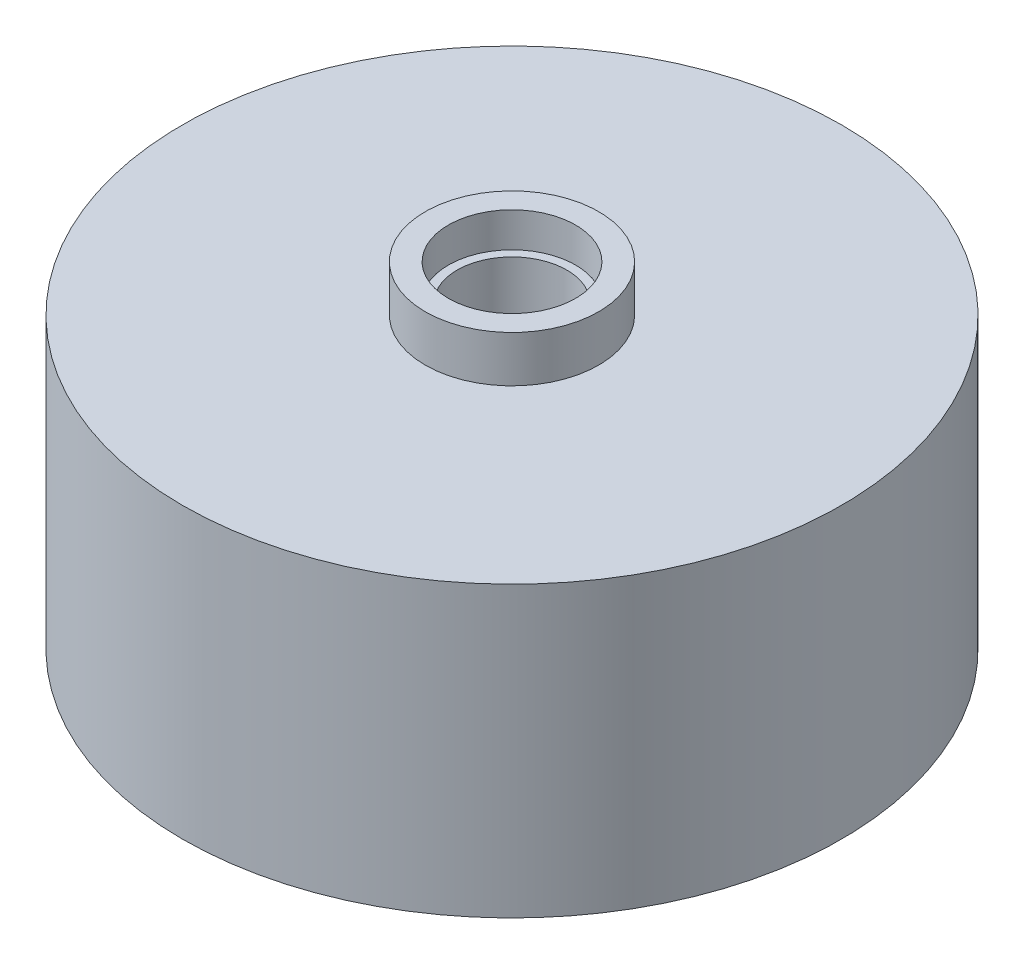
from build123d import *

# Parameters (mm, degrees)
EXTRUDE_1_DEPTH      = 12.5
EXTRUDE_1_DEPTH_BACK = 12.5
SKETCH_1_R           = 28.5
SKETCH_1_R_2         = 4.75
SKETCH_2_R           = 7.5
SKETCH_2_R_2         = 4.75
EXTRUDE_2_DEPTH      = 4
EXTRUDE_START        = 4
SKETCH_3_R           = 7.5
SKETCH_3_R_2         = 4.75
EXTRUDE_3_DEPTH      = 4
SKETCH_4_R           = 5.5
CUT_EXTRUDE_1_DEPTH  = 3
CUT_EXTRUDE_START    = -3
SKETCH_5_R           = 5.5
CUT_EXTRUDE_2_DEPTH  = 3


with BuildPart() as part:
    # 草图1 → 凸台-拉伸1 (new, two sides: drawn at the far end of the back side and taken through both)
    with BuildSketch(Plane(origin=(0, 0, 0), x_dir=(1, 0, 0), z_dir=(0, 1, 0)).offset(-EXTRUDE_1_DEPTH_BACK)):
        with Locations(Location((0, 0, 0), (0, 0, 270))):
            Circle(SKETCH_1_R)
        with Locations(Location((0, 0, 0), (0, 0, 270))):
            Circle(SKETCH_1_R_2, mode=Mode.SUBTRACT)
    extrude(amount=EXTRUDE_1_DEPTH + EXTRUDE_1_DEPTH_BACK)

    # 草图2 → 凸台-拉伸2 (add)
    with BuildSketch(Plane(origin=(0, 12.5, 0), x_dir=(1, 0, 0), z_dir=(0, 1, 0))):
        with Locations(Location((0, 0, 0), (0, 0, 270))):
            Circle(SKETCH_2_R)
        with Locations(Location((0, 0, 0), (0, 0, 270))):
            Circle(SKETCH_2_R_2, mode=Mode.SUBTRACT)
    extrude(amount=EXTRUDE_2_DEPTH)

    # 草图3 → 凸台-拉伸3 (add)
    with BuildSketch(Plane(origin=(0, -12.5, 0), x_dir=(-1, 0, 0), z_dir=(0, -1, 0)).offset(EXTRUDE_START)):
        with Locations(Location((0, 0, 0), (0, 0, 270))):
            Circle(SKETCH_3_R)
        with Locations(Location((0, 0, 0), (0, 0, 270))):
            Circle(SKETCH_3_R_2, mode=Mode.SUBTRACT)
    extrude(amount=-EXTRUDE_3_DEPTH)

    # 草图4 → 切除-拉伸1 (cut)
    with BuildSketch(Plane(origin=(0, 16.5, 0), x_dir=(1, 0, 0), z_dir=(0, 1, 0))):
        with Locations(Location((0, 0, 0), (0, 0, 270))):
            Circle(SKETCH_4_R)
    extrude(amount=-CUT_EXTRUDE_1_DEPTH, mode=Mode.SUBTRACT)

    # 草图5 → 切除-拉伸2 (cut)
    with BuildSketch(Plane(origin=(0, -16.5, 0), x_dir=(-1, 0, 0), z_dir=(0, -1, 0)).offset(CUT_EXTRUDE_START)):
        with Locations(Location((0, 0, 0), (0, 0, 270))):
            Circle(SKETCH_5_R)
    extrude(amount=CUT_EXTRUDE_2_DEPTH, mode=Mode.SUBTRACT)


solid = part.part
